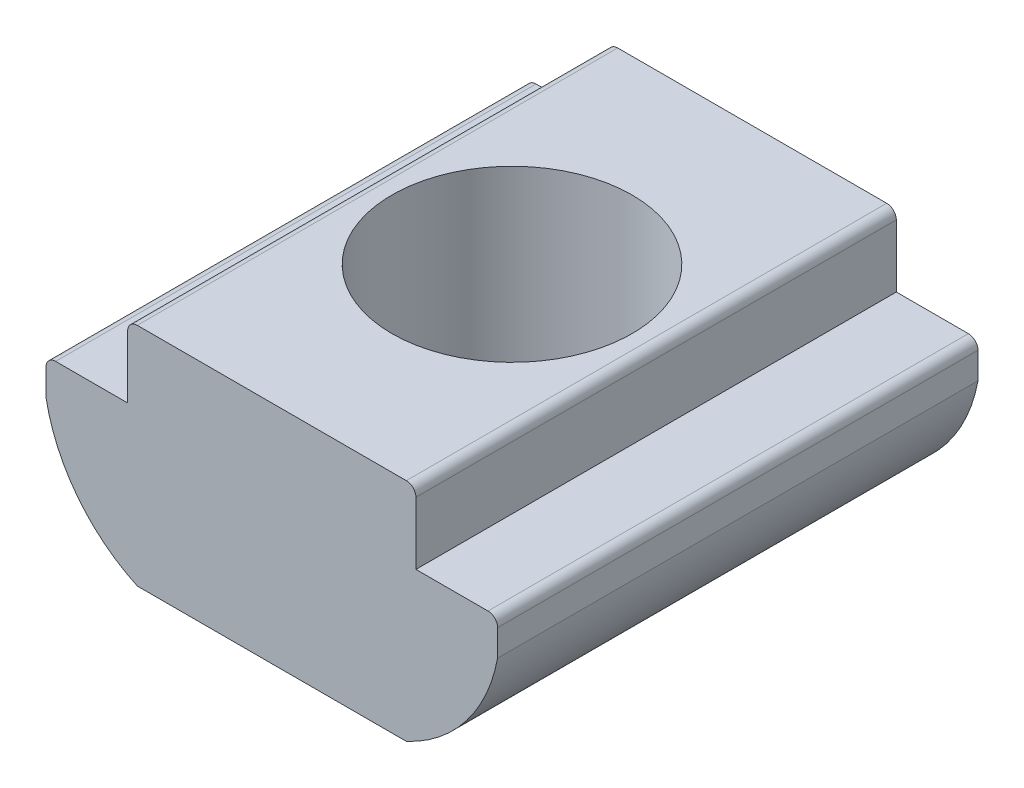
from build123d import *

# Parameters (mm, degrees)
EXTRUDE_1_DEPTH        = 5
HOLE_WIZARD_M6_1_D     = 5
HOLE_WIZARD_M6_1_DEPTH = 15
HOLE_WIZARD_M6_1_TIP   = 1.502151548


with BuildPart() as part:
    # 草图1 → 凸台-拉伸1 (new, symmetric)
    with BuildSketch(Plane.XY):
        with BuildLine():
            Line((-2.8, 4.7), (2.8, 4.7))
            ThreePointArc((2.8, 4.7), (2.941421356, 4.641421356), (3, 4.5))
            Line((3, 4.5), (3, 3.2))
            Line((3, 3.2), (4.5, 3.2))
            ThreePointArc((4.5, 3.2), (4.641421356, 3.141421356), (4.7, 3))
            Line((4.7, 3), (4.7, 2.45))
            ThreePointArc((4.7, 2.45), (4.047583818, 0.994220712), (2.8, 0))
            Line((2.8, 0), (-2.8, 0))
            ThreePointArc((-2.8, 0), (-4.047583818, 0.994220712), (-4.7, 2.45))
            Line((-4.7, 2.45), (-4.7, 3))
            ThreePointArc((-4.7, 3), (-4.641421356, 3.141421356), (-4.5, 3.2))
            Line((-4.5, 3.2), (-3, 3.2))
            Line((-3, 3.2), (-3, 4.5))
            ThreePointArc((-3, 4.5), (-2.941421356, 4.641421356), (-2.8, 4.7))
        make_face()
    extrude(amount=EXTRUDE_1_DEPTH, both=True)

    # M6 螺纹孔1
    with Locations(Plane.ZX.offset(4.7)):
        with Locations((0, 0)):
            Hole(HOLE_WIZARD_M6_1_D / 2, depth=HOLE_WIZARD_M6_1_DEPTH)
            with Locations((0, 0, -(HOLE_WIZARD_M6_1_DEPTH + HOLE_WIZARD_M6_1_TIP / 2))):  # 118° drill point
                Cone(0, HOLE_WIZARD_M6_1_D / 2, HOLE_WIZARD_M6_1_TIP, mode=Mode.SUBTRACT)


solid = part.part
